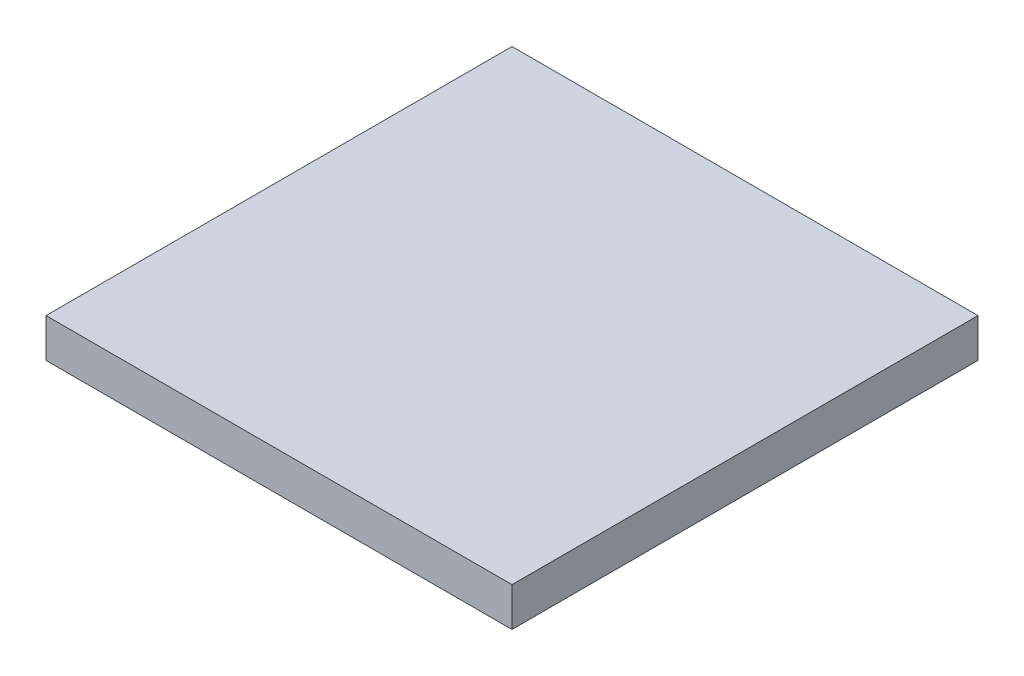
from build123d import *

# Parameters (mm, degrees)
SKETCH1_W           = 76.2
SKETCH1_H           = 76.2
BOSS_EXTRUDE1_DEPTH = 6.35


with BuildPart() as part:
    # Sketch1 → Boss-Extrude1 (new body)
    with BuildSketch(Plane(origin=(0, 0, 0), x_dir=(1, 0, 0), z_dir=(0, 1, 0))):
        Rectangle(SKETCH1_W, SKETCH1_H)
    extrude(amount=BOSS_EXTRUDE1_DEPTH)


solid = part.part
